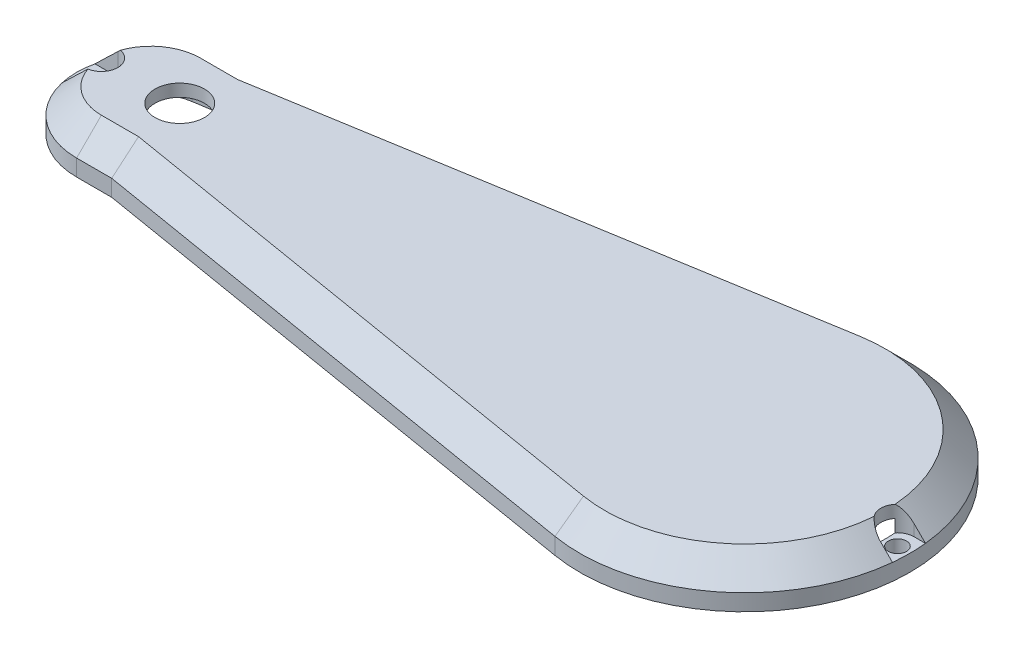
from build123d import *

# Parameters (mm, degrees)
SKETCH2_R           = 1.1
BOSS_EXTRUDE1_DEPTH = 5
SKETCH3_OUTSIDE_W   = 130.75
SKETCH3_OUTSIDE_H   = 69.75
CUT_EXTRUDE1_DEPTH  = 3
CUT_EXTRUDE1_DRAFT  = -45
CUT_EXTRUDE2_DEPTH  = 3
CUT_EXTRUDE3_DEPTH  = 3
SKETCH6_R           = 3
CUT_EXTRUDE4_DEPTH  = 9
CUT_EXTRUDE5_DEPTH  = 3.5


with BuildPart() as part:
    # Sketch2 → Boss-Extrude1 (new body)
    with BuildSketch(Plane(origin=(0, 0, 0), x_dir=(1, 0, 0), z_dir=(0, 1, 0))):
        with BuildLine():
            Line((-36.162601626, 8.29200542), (-31.906454434, 8.29200542))
            Line((-31.906454434, 8.29200542), (32.553816284, 19.020616336))
            ThreePointArc((32.553816284, 19.020616336), (55.837398374, -0.70799458), (32.553816284, -20.436605496))
            Line((32.553816284, -20.436605496), (-31.906454434, -9.70799458))
            Line((-31.906454434, -9.70799458), (-36.162601626, -9.70799458))
            ThreePointArc((-36.162601626, -9.70799458), (-45.162601626, -0.70799458), (-36.162601626, 8.29200542))
        make_face()
        with Locations(Location((-42.162601626, -0.70799458, 0), (0, 0, 270))):
            Circle(SKETCH2_R, mode=Mode.SUBTRACT)
        with Locations(Location((54.337398374, -0.70799458, 0), (0, 0, 270))):
            Circle(SKETCH2_R, mode=Mode.SUBTRACT)
    extrude(amount=BOSS_EXTRUDE1_DEPTH)


with BuildPart() as cut_extrude1_tool:
    # Sketch3 outside → Cut-Extrude1 (with draft: the straight prism first)
    with BuildSketch(Plane(origin=(0, 5, 0), x_dir=(1, 0, 0), z_dir=(0, 1, 0))):
        with Locations((5.337, -0.708)):
            Rectangle(SKETCH3_OUTSIDE_W, SKETCH3_OUTSIDE_H)
        with BuildLine():
            ThreePointArc((-36.162601626, 5.29200542), (-42.162601626, -0.70799458), (-36.162601626, -6.70799458))
            Line((-36.162601626, -6.70799458), (-31.658503498, -6.70799458))
            Line((-31.658503498, -6.70799458), (33.046353598, -17.477313858))
            ThreePointArc((33.046353598, -17.477313858), (52.837398374, -0.70799458), (33.046353598, 16.061324698))
            Line((33.046353598, 16.061324698), (-31.658503498, 5.29200542))
            Line((-31.658503498, 5.29200542), (-36.162601626, 5.29200542))
        make_face(mode=Mode.SUBTRACT)
    extrude(amount=-CUT_EXTRUDE1_DEPTH)
    # Cut-Extrude1: the draft: its side faces are tilted about the plane it starts from
    cut_extrude1_sides = [cut_extrude1_tool.faces().sort_by_distance(p)[0] for p in [
        (5.337, 3.5, 35.583),
        (70.712, 3.5, 0.708),
        (5.337, 3.5, -34.167),
        (-60.038, 3.5, 0.708),
        (-33.910552562, 3.5, -5.29200542),
        (0.69392505, 3.5, -10.676665059),
        (52.837398374, 3.5, 0.70799458),
        (0.69392505, 3.5, 12.092654219),
        (-33.910552562, 3.5, 6.70799458),
        (-42.162601626, 3.5, 0.70799458),
    ]]
    draft(cut_extrude1_sides, Plane(origin=(0, 5, 0), x_dir=(1, 0, 0), z_dir=(0, 1, 0)), CUT_EXTRUDE1_DRAFT)


with BuildPart() as part_1:
    add(part.part)

    # Cut-Extrude1: cut by cut_extrude1_tool
    add(cut_extrude1_tool.part, mode=Mode.SUBTRACT)

    # Sketch4 → Cut-Extrude2 (cut)
    with BuildSketch(Plane(origin=(0, 5, 0), x_dir=(1, 0, 0), z_dir=(0, 1, 0))):
        with BuildLine():
            Line((-42.162601626, 1.29200542), (-47.036094896, 1.29200542))
            Line((-47.036094896, 1.29200542), (-47.036094896, -2.70799458))
            Line((-47.036094896, -2.70799458), (-42.162601626, -2.70799458))
            ThreePointArc((-42.162601626, -2.70799458), (-40.162601626, -0.70799458), (-42.162601626, 1.29200542))
        make_face()
    extrude(amount=-CUT_EXTRUDE2_DEPTH, mode=Mode.SUBTRACT)

    # Sketch5 → Cut-Extrude3 (cut)
    with BuildSketch(Plane(origin=(0, 5, 0), x_dir=(1, 0, 0), z_dir=(0, 1, 0))):
        with BuildLine():
            Line((54.337398374, 1.29200542), (57.452649993, 1.29200542))
            Line((57.452649993, 1.29200542), (57.452649993, -2.70799458))
            Line((57.452649993, -2.70799458), (54.337398374, -2.70799458))
            ThreePointArc((54.337398374, -2.70799458), (52.337398374, -0.70799458), (54.337398374, 1.29200542))
        make_face()
    extrude(amount=-CUT_EXTRUDE3_DEPTH, mode=Mode.SUBTRACT)

    # Sketch6 → Cut-Extrude4 (cut)
    with BuildSketch(Plane(origin=(0, 5, 0), x_dir=(1, 0, 0), z_dir=(0, 1, 0))):
        with Locations(Location((-32.662601626, -0.70799458, 0), (0, 0, 270))):
            Circle(SKETCH6_R)
    extrude(amount=-CUT_EXTRUDE4_DEPTH, mode=Mode.SUBTRACT)

    # Sketch7 → Cut-Extrude5 (cut)
    with BuildSketch(Plane.XZ):
        with BuildLine():
            Line((-37.079268293, 6.637557989), (33.240176152, 17.508424239))
            ThreePointArc((33.240176152, 17.508424239), (52.837398374, 0.70799458), (33.240176152, -16.092435079))
            Line((33.240176152, -16.092435079), (-37.079268293, -5.221568829))
            ThreePointArc((-37.079268293, -5.221568829), (-42.162601626, 0.70799458), (-37.079268293, 6.637557989))
        make_face()
    extrude(amount=-CUT_EXTRUDE5_DEPTH, mode=Mode.SUBTRACT)


solid = part_1.part
